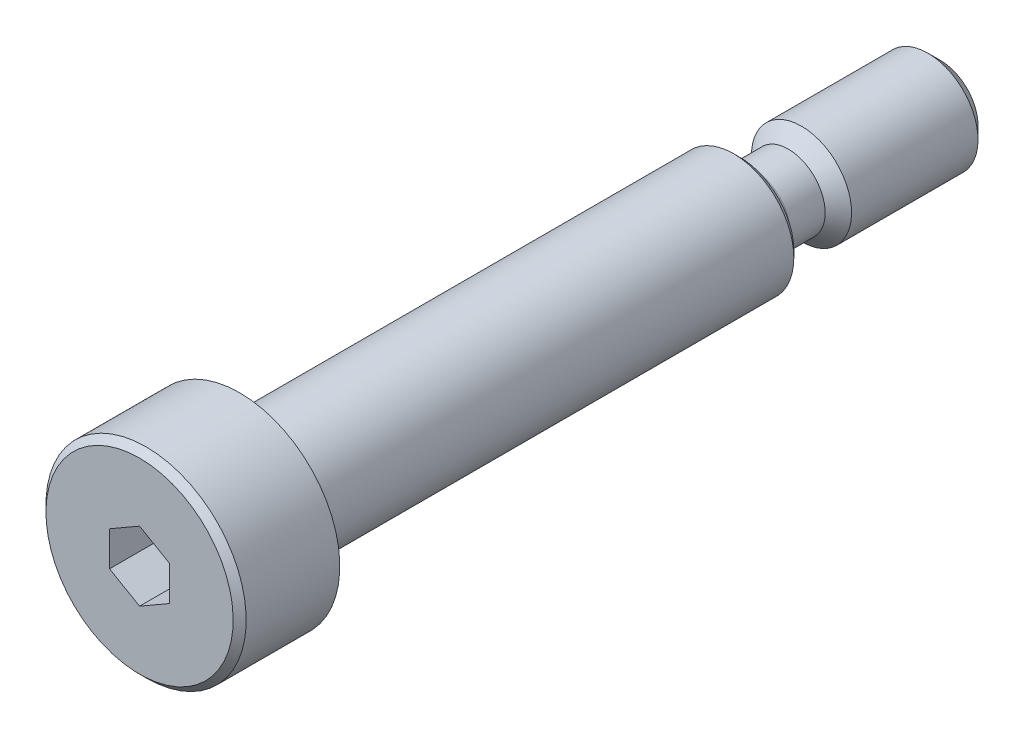
from build123d import *

# Parameters (mm, degrees)
SKETCH4_W          = 0.666666667
SKETCH4_H          = 0.666666667
CHAMFER1_SIZE      = 0.195
CHAMFER2_SIZE      = 0.625
CHAMFER3_SIZE      = 0.325
CUT_EXTRUDE1_DEPTH = 2.5


with BuildPart() as part:
    # Sketch3 → Revolve1 (revolve)
    with BuildSketch(Plane(origin=(0, 0, 0), x_dir=(0, 0, -1), z_dir=(1, 0, 0))):
        Polygon((-20, 5), (-15, 5), (-15, 3), (10, 3), (10, 2.5), (20, 2.5), (20, 0), (-20, 0), align=None)
    revolve(axis=Axis((0, 0, -20), (0, 0, 1)))

    # Sketch4 → Cut-Revolve1 (revolve, cut)
    with BuildSketch(Plane(origin=(0, 0, 0), x_dir=(0, 0, -1), z_dir=(1, 0, 0))):
        with Locations((-14.666666667, 2.666666667)):
            Rectangle(SKETCH4_W, SKETCH4_H)
    revolve(axis=Axis((0, 0, -20), (0, 0, 1)), mode=Mode.SUBTRACT)

    # Chamfer1
    chamfer1_edges = [part.edges().sort_by_distance(p)[0] for p in [
        (0, -3, 14.333333333),
        (0, -2.333333333, 14.333333333),
    ]]
    chamfer(chamfer1_edges, length=CHAMFER1_SIZE)

    # Sketch6 → Cut-Revolve2 (revolve, cut)
    with BuildSketch(Plane(origin=(0, 0, 0), x_dir=(0, 0, -1), z_dir=(1, 0, 0))):
        with BuildLine():
            Line((10, 3), (13.56, 3))
            Line((13.56, 3), (12.4, 1.84))
            Line((12.4, 1.84), (10.66, 1.84))
            ThreePointArc((10.66, 1.84), (10.193309524, 2.033309524), (10, 2.5))
            Line((10, 2.5), (10, 3))
        make_face()
    revolve(axis=Axis((0, 0, -20), (0, 0, 1)), mode=Mode.SUBTRACT)

    # Chamfer2
    chamfer2_edges = [part.edges().sort_by_distance(p)[0] for p in [
        (0, -2.5, -20),
    ]]
    chamfer(chamfer2_edges, length=CHAMFER2_SIZE)

    # Chamfer3
    chamfer3_edges = [part.edges().sort_by_distance(p)[0] for p in [
        (0, -5, 20),
        (0, -3, -10),
    ]]
    chamfer(chamfer3_edges, length=CHAMFER3_SIZE)

    # Sketch8 → Cut-Extrude1 (cut)
    with BuildSketch(Plane.XY.offset(20)):
        Polygon((1.5, 0.866025404), (0, 1.732050808), (-1.5, 0.866025404), (-1.5, -0.866025404), (0, -1.732050808), (1.5, -0.866025404), align=None)
    extrude(amount=-CUT_EXTRUDE1_DEPTH, mode=Mode.SUBTRACT)


solid = part.part
